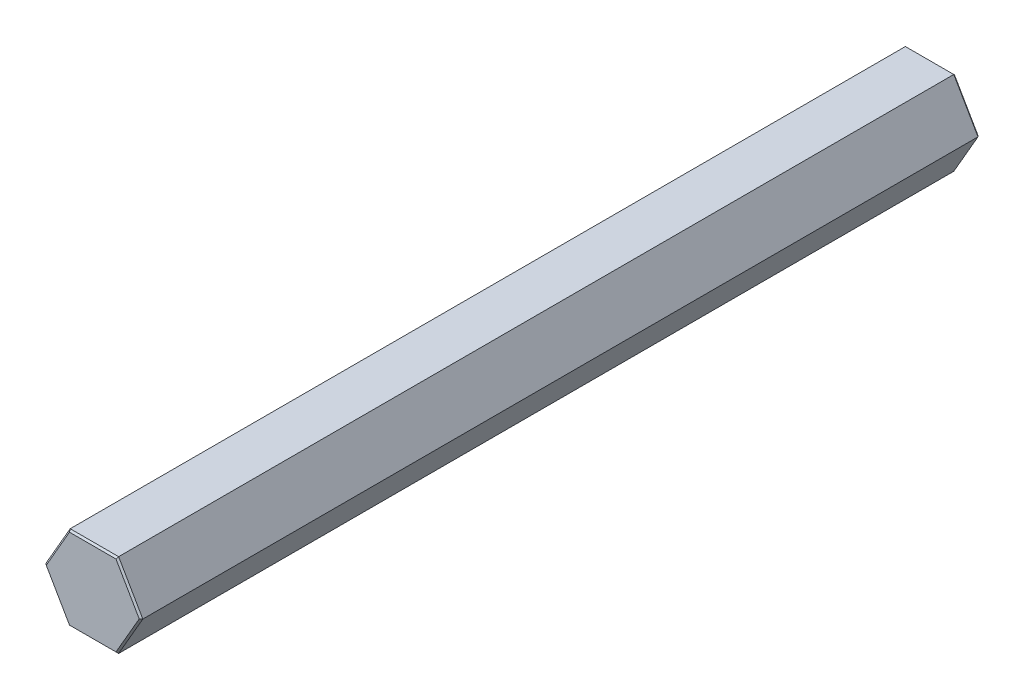
from build123d import *

# Parameters (mm, degrees)
BOSS_EXTRUDE1_DEPTH = 127
CHAMFER1_SIZE       = 0.254


with BuildPart() as part:
    # Sketch1 → Boss-Extrude1 (new body)
    with BuildSketch(Plane(origin=(0, 0, 0), x_dir=(-1, 0, 0), z_dir=(0, 0, -1))):
        Polygon((3.666174209, 6.35), (-3.666174209, 6.35), (-7.332348419, 0), (-3.666174209, -6.35), (3.666174209, -6.35), (7.332348419, 0), align=None)
    extrude(amount=-BOSS_EXTRUDE1_DEPTH)

    # Chamfer1
    chamfer1_edges = [part.edges().sort_by_distance(p)[0] for p in [
        (5.499261314, 3.175, 127),
        (5.499261314, -3.175, 127),
        (0, -6.35, 127),
        (-5.499261314, -3.175, 127),
        (-5.499261314, 3.175, 127),
        (-5.499261314, -3.175, 0),
        (0, -6.35, 0),
        (5.499261314, -3.175, 0),
        (5.499261314, 3.175, 0),
        (0, 6.35, 0),
        (-5.499261314, 3.175, 0),
        (0, 6.35, 127),
    ]]
    chamfer(chamfer1_edges, length=CHAMFER1_SIZE)


solid = part.part
